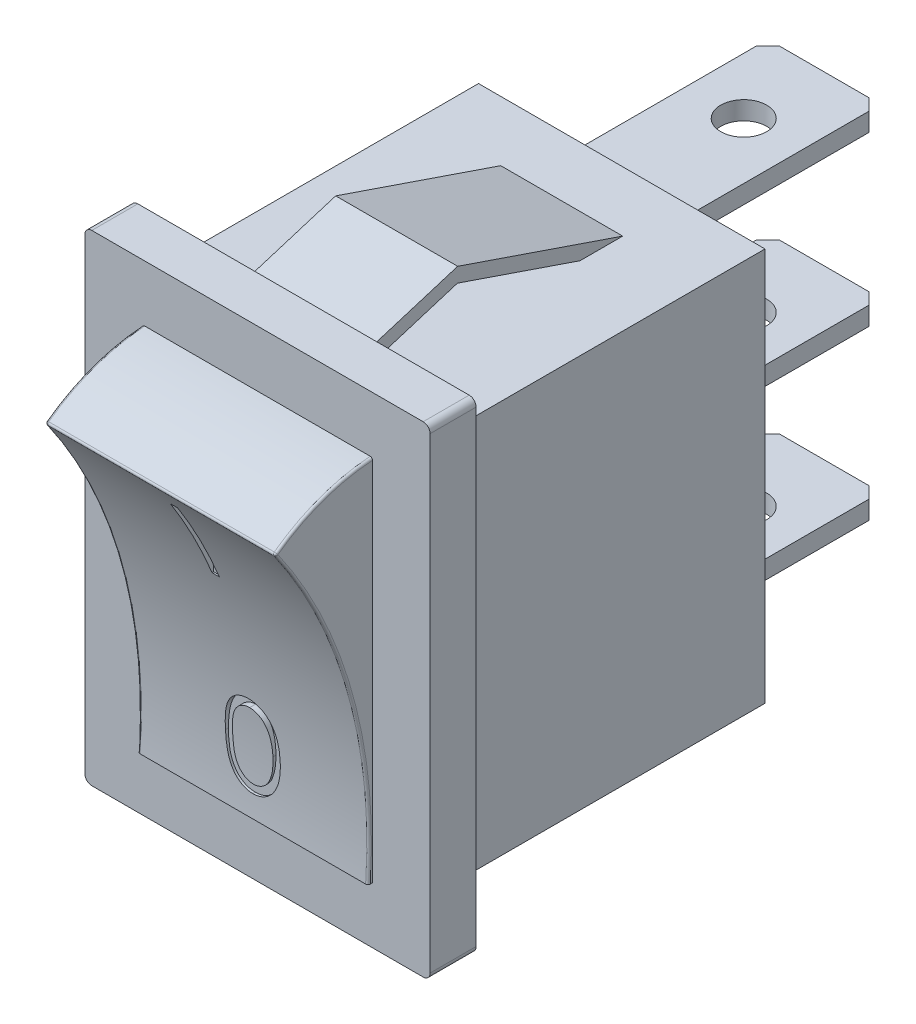
from build123d import *

# Parameters (mm, degrees)
SKETCH1_W           = 12.45
SKETCH1_H           = 17.1
BOSS_EXTRUDE1_DEPTH = 13.83
SKETCH2_W           = 15
SKETCH2_H           = 20.9
BOSS_EXTRUDE2_DEPTH = 2
BOSS_EXTRUDE3_DEPTH = 2.65
SKETCH4_W           = 4.9
SKETCH4_H           = 0.8
BOSS_EXTRUDE4_DEPTH = 8.8
CHAMFER1_SIZE       = 0.5
SKETCH5_R           = 1
CUT_EXTRUDE1_DEPTH  = 31.29945379
BOSS_EXTRUDE5_DEPTH = 5
FILLET2_R           = 0.1
CUT_EXTRUDE2_DEPTH  = 4.2
SKETCH8_W           = 0.314102564
SKETCH8_H           = 3.5
CUT_EXTRUDE3_DEPTH  = 2.5
FILLET3_R           = 0.3


with BuildPart() as part:
    # Sketch1 → Boss-Extrude1 (new body)
    with BuildSketch(Plane.XY):
        Rectangle(SKETCH1_W, SKETCH1_H)
    extrude(amount=-BOSS_EXTRUDE1_DEPTH)

    # Sketch2 → Boss-Extrude2 (add)
    with BuildSketch(Plane.XY):
        Rectangle(SKETCH2_W, SKETCH2_H)
    extrude(amount=BOSS_EXTRUDE2_DEPTH)

    # Sketch3 → Boss-Extrude3 (add, symmetric)
    with BuildSketch(Plane(origin=(0, 0, 0), x_dir=(0, 0, -1), z_dir=(1, 0, 0))):
        Polygon((0, 9.75), (4.048749721, 11), (11.221189781, 8.55), (9.365024857, 8.55), (4.039379328, 10.369162159), (0, 9.122055149), align=None)
        Polygon((0, -9.122055149), (0, -9.75), (4.048749721, -11), (11.221189781, -8.55), (9.365024857, -8.55), (4.039379328, -10.369162159), align=None)
    extrude(amount=BOSS_EXTRUDE3_DEPTH, both=True)

    # Sketch4 → Boss-Extrude4 (add)
    with BuildSketch(Plane(origin=(0, 0, -13.83), x_dir=(-1, 0, 0), z_dir=(0, 0, -1))):
        with Locations((0, -7.3)):
            Rectangle(SKETCH4_W, SKETCH4_H)
        Rectangle(SKETCH4_W, SKETCH4_H)
        with Locations((0, 7.3)):
            Rectangle(SKETCH4_W, SKETCH4_H)
    extrude(amount=BOSS_EXTRUDE4_DEPTH)

    # Chamfer1
    chamfer1_edges = [part.edges().sort_by_distance(p)[0] for p in [
        (2.45, -7.3, -22.63),
        (-2.45, -7.3, -22.63),
        (2.45, 0, -22.63),
        (-2.45, 0, -22.63),
        (2.45, 7.3, -22.63),
        (-2.45, 7.3, -22.63),
    ]]
    chamfer(chamfer1_edges, length=CHAMFER1_SIZE)

    # Sketch5 → Cut-Extrude1 (cut, through all)
    with BuildSketch(Plane(origin=(0, 7.7, 0), x_dir=(1, 0, 0), z_dir=(0, 1, 0))):
        with Locations(Location((0, 19.13, 0), (0, 0, 270))):
            Circle(SKETCH5_R)
    extrude(amount=-CUT_EXTRUDE1_DEPTH, mode=Mode.SUBTRACT)

    # Sketch6 → Boss-Extrude5 (add, symmetric)
    with BuildSketch(Plane(origin=(0, 0, 0), x_dir=(0, 0, -1), z_dir=(1, 0, 0))):
        with BuildLine():
            Line((-2, 8), (-2, -8))
            Line((-2, -8), (-2.2, -8))
            ThreePointArc((-2.2, -8), (-2.977273161, -0.43704815), (-6.25, 6.425287697))
            ThreePointArc((-6.25, 6.425287697), (-4.239569382, 7.521855806), (-2, 8))
        make_face()
    extrude(amount=BOSS_EXTRUDE5_DEPTH, both=True)

    # Fillet2
    fillet2_edges = [part.edges().sort_by_distance(p)[0] for p in [
        (-5, 7.521855806, 4.239569382),
        (-5, -0.43704815, 2.977273161),
        (0, 6.425287697, 6.25),
        (5, 7.521855806, 4.239569382),
        (5, -0.43704815, 2.977273161),
    ]]
    fillet(fillet2_edges, radius=FILLET2_R)

    # Sketch7 → Cut-Extrude2 (cut)
    with BuildSketch(Plane.XY.offset(6.25)):
        with BuildLine():
            add(Edge.make_bspline(
                [(-1.211538462, -5.251402244), (-1.211210443, -5.195304856), (-1.210573263, -5.086334872), (-1.203484842, -4.92755023), (-1.1917095, -4.778589941), (-1.175572127, -4.639446875), (-1.155934147, -4.51008511), (-1.12971866, -4.390850353), (-1.099905858, -4.281190746), (-1.065353412, -4.180748698), (-1.026365623, -4.088170995), (-0.983931362, -4.001745793), (-0.936366568, -3.921603861), (-0.886389655, -3.846466071), (-0.831977583, -3.777562376), (-0.774678793, -3.713919713), (-0.712256917, -3.657008963), (-0.646833908, -3.605162661), (-0.577817444, -3.559713189), (-0.507174778, -3.51968045), (-0.434419672, -3.485480583), (-0.359353489, -3.458590147), (-0.282650931, -3.4363793), (-0.204043864, -3.421190353), (-0.1234025, -3.411633444), (-0.068971066, -3.410719776), (-0.041366186, -3.41025641)],
                knots=[0, 0, 0, 0, 1.646270934, 3.197905019, 4.663502075, 6.030701355, 7.308322542, 8.50163776, 9.611534131, 10.641858119, 11.616356847, 12.558055219, 13.465016945, 14.349605745, 15.204443733, 16.039544428, 16.859896111, 17.680448484, 18.487036065, 19.28249412, 20.06191084, 20.843045899, 21.620316918, 22.403196591, 23.190181807, 24, 24, 24, 24], degree=3))
            add(Edge.make_bspline(
                [(-0.041366186, -3.41025641), (-0.013530707, -3.410744225), (0.041825301, -3.411714336), (0.123665677, -3.421038279), (0.203615358, -3.436509402), (0.281333497, -3.458430377), (0.357458484, -3.485626053), (0.431394891, -3.51971317), (0.503601973, -3.559392038), (0.57293226, -3.606015915), (0.640146876, -3.657998191), (0.703594839, -3.71676086), (0.763281925, -3.781710579), (0.81995723, -3.852152443), (0.872012827, -3.929437528), (0.921586259, -4.012221638), (0.965958295, -4.101952503), (1.008692971, -4.19713297), (1.045579957, -4.300396629), (1.078846203, -4.41116139), (1.105725171, -4.530735577), (1.128114443, -4.658491822), (1.145459339, -4.794899305), (1.158091981, -4.939665621), (1.164765067, -5.092886011), (1.166021768, -5.19764386), (1.166666667, -5.251402244)],
                knots=[0, 0, 0, 0, 0.810914788, 1.612654377, 2.396697861, 3.181598691, 3.963628158, 4.749916497, 5.551656086, 6.361998678, 7.18212741, 8.025565596, 8.878627764, 9.750805457, 10.657531673, 11.591944965, 12.560506719, 13.57287815, 14.630710178, 15.753379473, 16.941251878, 18.199788006, 19.531962791, 20.947069417, 22.433333509, 24, 24, 24, 24], degree=3))
            add(Edge.make_bspline(
                [(1.166666667, -5.251402244), (1.166015082, -5.304926152), (1.164745496, -5.409215303), (1.158166789, -5.561746279), (1.145208158, -5.705744322), (1.12899817, -5.841554784), (1.106547207, -5.968612403), (1.078942041, -6.087356852), (1.048291718, -6.198300923), (1.010456924, -6.300535735), (0.969046213, -6.395487458), (0.923991017, -6.484154606), (0.875721191, -6.567320899), (0.823132446, -6.644320646), (0.767079033, -6.715699303), (0.706361244, -6.780196926), (0.642690659, -6.839367598), (0.575278243, -6.892019225), (0.504866692, -6.93810403), (0.432907615, -6.97931788), (0.358124232, -7.012550575), (0.282211279, -7.041085616), (0.204082913, -7.062886068), (0.123836522, -7.077959923), (0.041880286, -7.088531772), (-0.013521279, -7.089338252), (-0.041366186, -7.08974359)],
                knots=[0, 0, 0, 0, 1.561518951, 3.042555995, 4.452378317, 5.7783523, 7.031515105, 8.214008947, 9.334062868, 10.386615937, 11.391082383, 12.354592575, 13.286541444, 14.194233754, 15.072674879, 15.931287219, 16.775624067, 17.606195743, 18.42308326, 19.229000347, 20.022332153, 20.807536673, 21.593273796, 22.3848459, 23.188221202, 24, 24, 24, 24], degree=3))
            add(Edge.make_bspline(
                [(-0.041366186, -7.08974359), (-0.0689703, -7.089277234), (-0.123400225, -7.088357672), (-0.20405265, -7.078843941), (-0.282335094, -7.063548438), (-0.358633848, -7.042131834), (-0.433340363, -7.015916997), (-0.505436649, -6.981763314), (-0.575724333, -6.942429245), (-0.644015889, -6.897633823), (-0.70902805, -6.84631214), (-0.771126655, -6.789547851), (-0.828751674, -6.72592444), (-0.88238577, -6.656446517), (-0.933359858, -6.581753275), (-0.980249232, -6.500824902), (-1.023620086, -6.413982291), (-1.063263576, -6.32066438), (-1.09841224, -6.219509453), (-1.129459948, -6.109360274), (-1.153974105, -5.989244638), (-1.174957061, -5.860127271), (-1.191881444, -5.721453341), (-1.203435769, -5.573147562), (-1.210577084, -5.415302353), (-1.211212155, -5.307032579), (-1.211538462, -5.251402244)],
                knots=[0, 0, 0, 0, 0.810891512, 1.598919785, 2.382837074, 3.152667961, 3.926044502, 4.706494248, 5.493654104, 6.291793342, 7.103789334, 7.925228297, 8.761435821, 9.622817696, 10.50288917, 11.416980706, 12.369136599, 13.353924996, 14.394355917, 15.514179734, 16.714354668, 17.994756427, 19.357759367, 20.818452758, 22.365282078, 24, 24, 24, 24], degree=3))
        make_face()
        with BuildLine():
            add(Edge.make_bspline(
                [(-0.897435897, -5.25), (-0.89731645, -5.296748699), (-0.897084627, -5.387478744), (-0.891028426, -5.519322005), (-0.882778194, -5.642292333), (-0.872136897, -5.75654587), (-0.856333949, -5.861695882), (-0.838627161, -5.958465565), (-0.817079071, -6.046342803), (-0.791584053, -6.125930613), (-0.762544957, -6.198579682), (-0.730839093, -6.266180897), (-0.69677837, -6.329532833), (-0.658659219, -6.388066442), (-0.617144156, -6.441972606), (-0.573170897, -6.492205438), (-0.525098313, -6.537002419), (-0.45859457, -6.590729274), (-0.370798096, -6.646248408), (-0.260177641, -6.694594498), (-0.14650919, -6.724976954), (-0.06935794, -6.72884071), (-0.030849359, -6.730769231)],
                knots=[0, 0, 0, 0, 1.459021318, 2.831673884, 4.118529203, 5.306027144, 6.411944654, 7.436330062, 8.375795394, 9.233974572, 10.042671642, 10.816086306, 11.563610507, 12.285937304, 12.993564865, 13.685989202, 14.367179055, 15.041617293, 16.353048772, 17.594441528, 18.799311195, 20, 20, 20, 20], degree=3))
            add(Edge.make_bspline(
                [(-0.030849359, -6.730769231), (0.007908313, -6.72917145), (0.085343636, -6.725979187), (0.198477431, -6.69518045), (0.308307701, -6.64871091), (0.394379641, -6.593763405), (0.459862185, -6.541435075), (0.506779175, -6.496820427), (0.549841223, -6.44686456), (0.590683298, -6.392965264), (0.628142374, -6.33409278), (0.662205512, -6.270530204), (0.693288859, -6.202101027), (0.710997905, -6.154331287), (0.720052083, -6.129907853)],
                knots=[0, 0, 0, 0, 1.353760809, 2.704726607, 4.075137775, 5.516104923, 6.260822281, 7.007110065, 7.778089737, 8.566572457, 9.372053459, 10.217411131, 11.088608312, 12, 12, 12, 12], degree=3))
            add(Edge.make_bspline(
                [(0.720052083, -6.129907853), (0.730603851, -6.098678113), (0.752028465, -6.035268349), (0.779640239, -5.936904697), (0.801385638, -5.833701933), (0.820949004, -5.726276816), (0.83430206, -5.613837115), (0.845049873, -5.496730731), (0.85138056, -5.374869369), (0.852165311, -5.292074378), (0.852564103, -5.25)],
                knots=[0, 0, 0, 0, 0.884706709, 1.796334032, 2.740027952, 3.714592787, 4.726048262, 5.777819803, 6.87074269, 8, 8, 8, 8], degree=3))
            add(Edge.make_bspline(
                [(0.852564103, -5.25), (0.852013913, -5.207932427), (0.850937626, -5.125639263), (0.846823638, -5.005121082), (0.836200063, -4.890653321), (0.824400945, -4.781742848), (0.807003723, -4.678992546), (0.788245917, -4.581542241), (0.763044704, -4.490599216), (0.736124929, -4.404739634), (0.705314534, -4.324938979), (0.671398799, -4.250825193), (0.635177041, -4.182040468), (0.5958348, -4.118773527), (0.553839117, -4.060740984), (0.508081568, -4.009106389), (0.460377195, -3.962269421), (0.393560009, -3.908806852), (0.30608572, -3.854295157), (0.197240072, -3.804129397), (0.083969428, -3.775321104), (0.007395974, -3.771259417), (-0.030849359, -3.769230769)],
                knots=[0, 0, 0, 0, 1.31362396, 2.569729283, 3.763502607, 4.902122613, 5.988968491, 7.01645872, 7.998833611, 8.933434873, 9.825090667, 10.667526885, 11.477055099, 12.250526234, 12.991942729, 13.710640831, 14.402115721, 15.076753259, 16.378508321, 17.609869233, 18.806226677, 20, 20, 20, 20], degree=3))
            add(Edge.make_bspline(
                [(-0.030849359, -3.769230769), (-0.069559951, -3.771262216), (-0.147051657, -3.77532881), (-0.261499611, -3.804022064), (-0.371203963, -3.85403503), (-0.458446938, -3.908987402), (-0.525310724, -3.961325713), (-0.572393418, -4.006712167), (-0.61653959, -4.056358422), (-0.65720729, -4.110760337), (-0.695296573, -4.169225704), (-0.730277586, -4.232214469), (-0.761794915, -4.300045833), (-0.790879452, -4.372662268), (-0.81645224, -4.452243213), (-0.837546203, -4.540012206), (-0.857033256, -4.636474098), (-0.870828525, -4.742193606), (-0.883092281, -4.85647576), (-0.890973629, -4.979753078), (-0.897104886, -5.111817458), (-0.89732335, -5.203016617), (-0.897435897, -5.25)],
                knots=[0, 0, 0, 0, 1.207732386, 2.417664972, 3.655092373, 4.956220595, 5.625982001, 6.301752483, 6.994047911, 7.697131622, 8.419323945, 9.170223765, 9.943494443, 10.752040957, 11.610060368, 12.549350801, 13.567764191, 14.679664412, 15.874934091, 17.154273443, 18.533957287, 20, 20, 20, 20], degree=3))
        make_face(mode=Mode.SUBTRACT)
    extrude(amount=-CUT_EXTRUDE2_DEPTH, mode=Mode.SUBTRACT)

    # Sketch8 → Cut-Extrude3 (cut)
    with BuildSketch(Plane.XY.offset(6.25)):
        with Locations((0, 3.75)):
            Rectangle(SKETCH8_W, SKETCH8_H)
    extrude(amount=-CUT_EXTRUDE3_DEPTH, mode=Mode.SUBTRACT)

    # Fillet3
    fillet3_edges = [part.edges().sort_by_distance(p)[0] for p in [
        (7.5, 10.45, 1),
        (-7.5, 10.45, 1),
        (-7.5, -10.45, 1),
        (7.5, -10.45, 1),
    ]]
    fillet(fillet3_edges, radius=FILLET3_R)


solid = part.part
